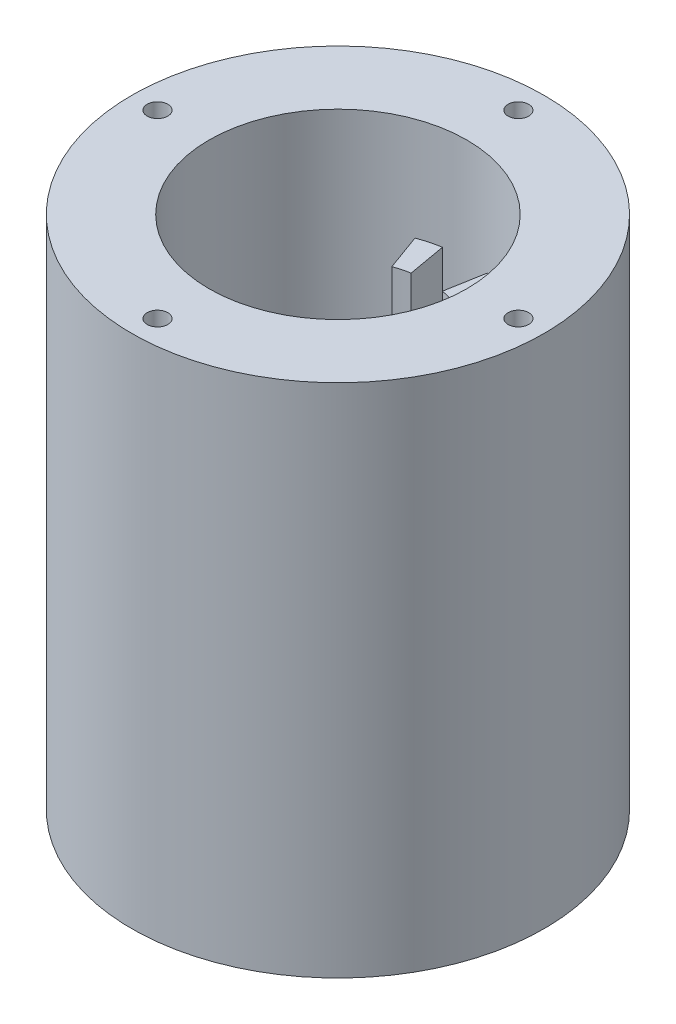
from build123d import *

# Parameters (mm, degrees)
SKETCH1_R           = 40
SKETCH1_R_2         = 25
BOSS_EXTRUDE1_DEPTH = 50
SKETCH2_R           = 2
CUT_EXTRUDE1_DEPTH  = 10
BOSS_EXTRUDE2_START = -30
BOSS_EXTRUDE2_DEPTH = 50


with BuildPart() as part:
    # Sketch1 → Boss-Extrude1 (new, symmetric)
    with BuildSketch(Plane(origin=(0, 0, 0), x_dir=(1, 0, 0), z_dir=(0, 1, 0))):
        with Locations(Location((0, 0, 0), (0, 0, 90))):
            Circle(SKETCH1_R)
        with Locations(Location((0, 0, 0), (0, 0, 90))):
            Circle(SKETCH1_R_2, mode=Mode.SUBTRACT)
    extrude(amount=BOSS_EXTRUDE1_DEPTH, both=True)

    # Sketch2 → Cut-Extrude1 (cut)
    with BuildSketch(Plane(origin=(0, 50, 0), x_dir=(1, 0, 0), z_dir=(0, 1, 0))):
        with Locations(Location((0, 35, 0), (0, 0, 270))):
            Circle(SKETCH2_R)
        with Locations(Location((35, 0, 0), (0, 0, 270))):
            Circle(SKETCH2_R)
        with Locations(Location((0, -35, 0), (0, 0, 270))):
            Circle(SKETCH2_R)
        with Locations(Location((-35, 0, 0), (0, 0, 270))):
            Circle(SKETCH2_R)
    cut_extrude1 = extrude(amount=-CUT_EXTRUDE1_DEPTH, mode=Mode.SUBTRACT)

    # Mirror1: Cut-Extrude1 across plane
    add(cut_extrude1.mirror(Plane.ZX), mode=Mode.SUBTRACT)

    # Sketch3 → Boss-Extrude2 (add)
    with BuildSketch(Plane.XZ.offset(50).offset(BOSS_EXTRUDE2_START)):
        with BuildLine():
            ThreePointArc((-5.985352508, 16.444620864), (-4.529333289, 16.90370196), (-3.038843109, 17.234135678))
            Line((-3.038843109, 17.234135678), (-4.341204442, 24.620193825))
            ThreePointArc((-4.341204442, 24.620193825), (-6.470476128, 24.148145657), (-8.550503583, 23.49231552))
            Line((-8.550503583, 23.49231552), (-5.985352508, 16.444620864))
        make_face()
        with BuildLine():
            Line((4.341204442, 24.620193825), (3.038843109, 17.234135678))
            ThreePointArc((3.038843109, 17.234135678), (4.529333289, 16.90370196), (5.985352508, 16.444620864))
            Line((5.985352508, 16.444620864), (8.550503583, 23.49231552))
            ThreePointArc((8.550503583, 23.49231552), (6.470476128, 24.148145657), (4.341204442, 24.620193825))
        make_face()
    boss_extrude2 = extrude(amount=-BOSS_EXTRUDE2_DEPTH)

    # Mirror2: Boss-Extrude2 across plane
    add(boss_extrude2.mirror(Plane.XY))


solid = part.part
